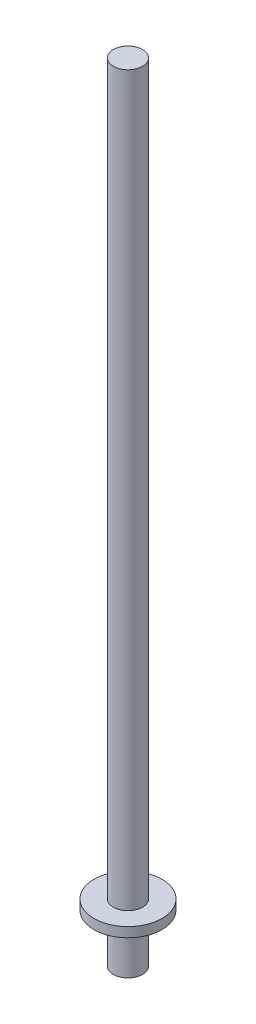
from build123d import *


with BuildPart() as part:
    # Sketch1 → Revolve1 (revolve)
    with BuildSketch(Plane.XY, mode=Mode.PRIVATE) as revolve1_sk:
        Polygon((0, 0), (3, 0), (3, -150), (7, -150), (7, -152), (3, -152), (3, -162), (0, -162), align=None)
    revolve(revolve1_sk.sketch.rotate(Axis((0, 11.674388023, 0), (0, -1, 0)), 90), axis=Axis((0, 11.674388023, 0), (0, -1, 0)))


solid = part.part
